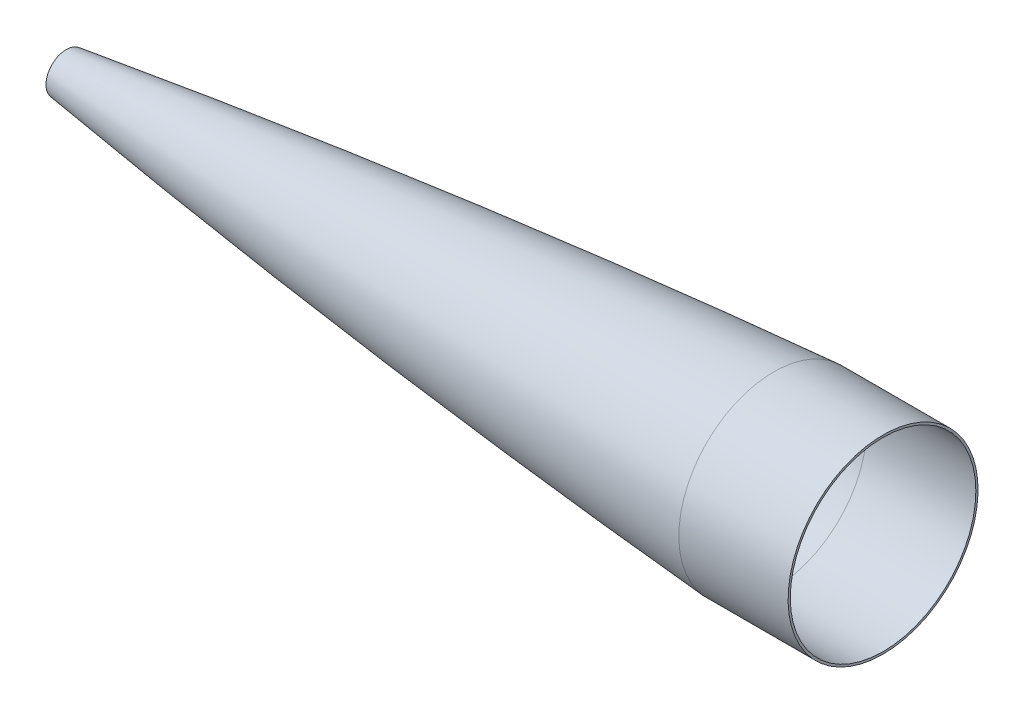
from build123d import *

# Parameters (mm, degrees)
SKETCH14_W         = 99.852899645
SKETCH14_H         = 2
CUT_EXTRUDE1_DEPTH = 50
CUT_EXTRUDE2_REACH = 760.286
SKETCH21_R         = 3


with BuildPart() as part:
    # Sketch1 → Revolve1 (revolve)
    with BuildSketch(Plane(origin=(0, 0, 0), x_dir=(-1, 0, 0), z_dir=(0, 0, -1)), mode=Mode.PRIVATE) as revolve1_sk:
        with BuildLine():
            Line((-763.382394472, 85), (-763.235294117, 85))
            ThreePointArc((-763.235294117, 85), (-461.926690188, 58.32401398), (-161.53152562, 22.810240092))
            Line((-161.53152562, 22.810240092), (-161.53152562, 0))
            Line((-161.53152562, 0), (18.46847438, 0))
            Line((18.46847438, 0), (0.295326728, 1.978075358))
            ThreePointArc((0.295326728, 1.978075358), (-380.640283603, 51.608700281), (-763.161647781, 87))
            Line((-763.161647781, 87), (-763.382394472, 87))
            Line((-763.382394472, 87), (-763.382394472, 85))
        make_face()
    revolve(revolve1_sk.sketch.rotate(Axis((763.235294117, 0, 0), (-1, 0, 0)), 180), axis=Axis((763.235294117, 0, 0), (-1, 0, 0)))

    # Sketch14 → Revolve4 (revolve)
    with BuildSketch(Plane(origin=(0, 0, 0), x_dir=(-1, 0, 0), z_dir=(0, 0, -1)), mode=Mode.PRIVATE) as revolve4_sk:
        with Locations((-813.308844295, 86)):
            Rectangle(SKETCH14_W, SKETCH14_H)
    revolve(revolve4_sk.sketch.rotate(Axis((763.235294117, 0, 0), (1, 0, 0)), 180), axis=Axis((763.235294117, 0, 0), (1, 0, 0)))

    # Sketch15 → Cut-Extrude1 (cut, symmetric)
    with BuildSketch(Plane.XY):
        Polygon((-1798.394426372, -1.080422086), (-17.779665104, -0.07497417), (114.997091286, 0), (114.997091286, 42.308767364), (-24.793740749, 42.308767364), (-24.793740749, -36.098631976), (114.997091286, -36.098631976), (114.997091286, 0), (114.997091286, 1780.615045137), (-2311.882223875, 4386.879909942), (-4225.273741533, 2605.184442719), align=None)
    extrude(amount=CUT_EXTRUDE1_DEPTH, both=True, mode=Mode.SUBTRACT)


with BuildPart() as cut_extrude1_kept_piece:
    # of the separate pieces the step leaves, the one the design keeps (cut_extrude1_pieces_kept)
    add(part.part.solids().sort_by_distance((763.161647781, -87, 0))[0])

    # Sketch21 → Cut-Extrude2 (cut, up to next)
    with BuildSketch(Plane.ZY.offset(-114.997091286), mode=Mode.PRIVATE) as cut_extrude2_sk1:
        with Locations(Location((0, 0, 0), (0, 0, 270))):
            Circle(SKETCH21_R)
    cut_extrude2_tool1 = extrude(cut_extrude2_sk1.sketch, amount=-CUT_EXTRUDE2_REACH, mode=Mode.PRIVATE) & cut_extrude1_kept_piece.part
    add(cut_extrude2_tool1.solids().sort_by_distance((114.997091, 0, 0))[0], mode=Mode.SUBTRACT)


solid = cut_extrude1_kept_piece.part
